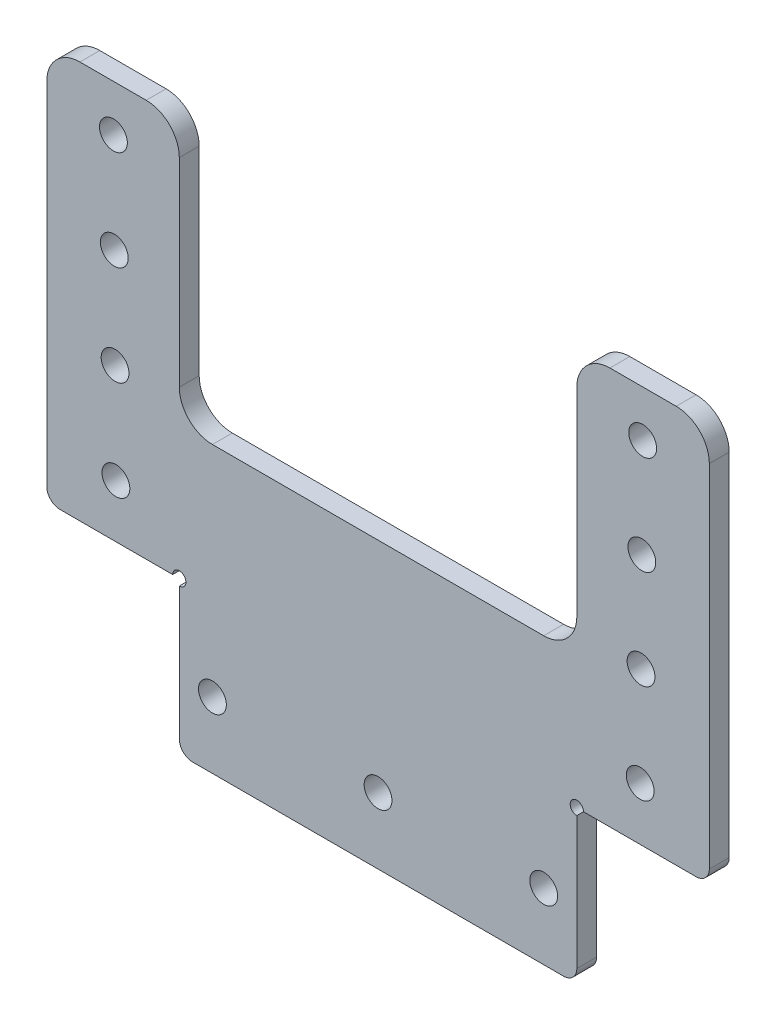
from build123d import *

# Parameters (mm, degrees)
SKETCH1_W           = 60
SKETCH1_H           = 23
BOSS_EXTRUDE1_DEPTH = 3
BOSS_EXTRUDE2_DEPTH = 3
SKETCH3_R           = 1
CUT_EXTRUDE1_DEPTH  = 88.299770905
FILLET1_R           = 2
SKETCH4_R           = 2.1
CUT_EXTRUDE2_DEPTH  = 88.299770905
SKETCH5_R           = 2.1
CUT_EXTRUDE3_DEPTH  = 88.299770905
FILLET2_R           = 5


with BuildPart() as part:
    # Sketch1 → Boss-Extrude1 (new body)
    with BuildSketch(Plane.XY):
        Rectangle(SKETCH1_W, SKETCH1_H)
    extrude(amount=BOSS_EXTRUDE1_DEPTH)

    # Sketch2 → Boss-Extrude2 (add)
    with BuildSketch(Plane.XY.offset(3)):
        Polygon((50, 11.5), (-50, 11.5), (-50, 71.5), (-30, 71.5), (-30, 31.5), (30, 31.5), (30, 71.5), (50, 71.5), align=None)
    extrude(amount=-BOSS_EXTRUDE2_DEPTH)

    # Sketch3 → Cut-Extrude1 (cut, through all)
    with BuildSketch(Plane.XY.offset(3)):
        with Locations((-30, 11.5)):
            Circle(SKETCH3_R)
        with Locations((30, 11.5)):
            Circle(SKETCH3_R)
    extrude(amount=-CUT_EXTRUDE1_DEPTH, mode=Mode.SUBTRACT)

    # Fillet1
    fillet1_edges = [part.edges().sort_by_distance(p)[0] for p in [
        (50, 11.5, 1.5),
        (-50, 11.5, 1.5),
        (30, -11.5, 1.5),
        (-30, -11.5, 1.5),
    ]]
    fillet(fillet1_edges, radius=FILLET1_R)

    # Sketch4 → Cut-Extrude2 (cut, through all)
    with BuildSketch(Plane.XY.offset(3)):
        with Locations((-25, -1.5)):
            Circle(SKETCH4_R)
        with Locations((0, -1.5)):
            Circle(SKETCH4_R)
        with Locations((25, -1.5)):
            Circle(SKETCH4_R)
    extrude(amount=-CUT_EXTRUDE2_DEPTH, mode=Mode.SUBTRACT)

    # Sketch5 → Cut-Extrude3 (cut, through all)
    with BuildSketch(Plane.XY.offset(3)):
        with Locations((-39.941666667, 64.5)):
            Circle(SKETCH5_R)
        with Locations((-39.816671007, 49.500520806)):
            Circle(SKETCH5_R)
        with Locations((-39.691675347, 34.501041612)):
            Circle(SKETCH5_R)
        with Locations((-39.566679687, 19.501562419)):
            Circle(SKETCH5_R)
        with Locations(Location((39.566679687, 19.501562419, 0), (0, 0, 180))):
            Circle(SKETCH5_R)
        with Locations(Location((39.691675347, 34.501041612, 0), (0, 0, 180))):
            Circle(SKETCH5_R)
        with Locations(Location((39.816671007, 49.500520806, 0), (0, 0, 180))):
            Circle(SKETCH5_R)
        with Locations(Location((39.941666667, 64.5, 0), (0, 0, 180))):
            Circle(SKETCH5_R)
    extrude(amount=-CUT_EXTRUDE3_DEPTH, mode=Mode.SUBTRACT)

    # Fillet2
    fillet2_edges = [part.edges().sort_by_distance(p)[0] for p in [
        (50, 71.5, 1.5),
        (30, 71.5, 1.5),
        (30, 31.5, 1.5),
        (-30, 31.5, 1.5),
        (-30, 71.5, 1.5),
        (-50, 71.5, 1.5),
    ]]
    fillet(fillet2_edges, radius=FILLET2_R)


solid = part.part
